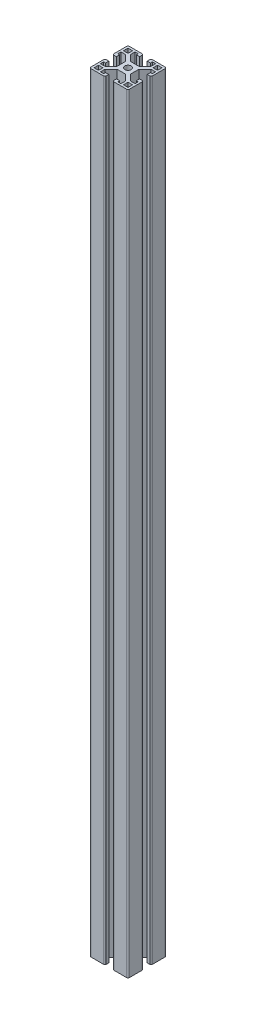
from build123d import *

# Parameters (mm, degrees)
SKETCH1_R           = 2.5
SKETCH1_W           = 3.5
SKETCH1_H           = 3.5
BOSS_EXTRUDE1_DEPTH = 600
FILLET1_R           = 1


with BuildPart() as part:
    # Sketch1 → Boss-Extrude1 (new body)
    with BuildSketch(Plane(origin=(0, 0, 0), x_dir=(1, 0, 0), z_dir=(0, 1, 0))):
        Polygon((-15, 7.5), (-15, -4.5), (-12, -4.5), (-12, -2), (-13.5, -2), (-13.5, 0.5), (-10, 0.5), (-5.25, -4.25), (-5.25, -10.75), (-10, -15.5), (-13.5, -15.5), (-13.5, -13), (-12, -13), (-12, -10.5), (-15, -10.5), (-15, -22.5), (-3, -22.5), (-3, -19.5), (-5.5, -19.5), (-5.5, -21), (-8, -21), (-8, -17.5), (-3.25, -12.75), (3.25, -12.75), (8, -17.5), (8, -21), (5.5, -21), (5.5, -19.5), (3, -19.5), (3, -22.5), (15, -22.5), (15, -10.5), (12, -10.5), (12, -13), (13.5, -13), (13.5, -15.5), (10, -15.5), (5.25, -10.75), (5.25, -4.25), (10, 0.5), (13.5, 0.5), (13.5, -2), (12, -2), (12, -4.5), (15, -4.5), (15, 7.5), (3, 7.5), (3, 4.5), (5.5, 4.5), (5.5, 6), (8, 6), (8, 2.5), (3.25, -2.25), (-3.25, -2.25), (-8, 2.5), (-8, 6), (-5.5, 6), (-5.5, 4.5), (-3, 4.5), (-3, 7.5), align=None)
        with Locations(Location((0, -7.5, 0), (0, 0, 270))):
            Circle(SKETCH1_R, mode=Mode.SUBTRACT)
        with Locations((-11.5, 4)):
            Rectangle(SKETCH1_W, SKETCH1_H, mode=Mode.SUBTRACT)
        with Locations((11.5, 4)):
            Rectangle(SKETCH1_W, SKETCH1_H, mode=Mode.SUBTRACT)
        with Locations((11.5, -19)):
            Rectangle(SKETCH1_W, SKETCH1_H, mode=Mode.SUBTRACT)
        with Locations((-11.5, -19)):
            Rectangle(SKETCH1_W, SKETCH1_H, mode=Mode.SUBTRACT)
    extrude(amount=-BOSS_EXTRUDE1_DEPTH)

    # Fillet1
    fillet1_edges = [part.edges().sort_by_distance(p)[0] for p in [
        (15, -300, 10.5),
        (15, -300, 22.5),
        (3, -300, 22.5),
        (-3, -300, 22.5),
        (-15, -300, 22.5),
        (-15, -300, 10.5),
        (-15, -300, 4.5),
        (-15, -300, -7.5),
        (-3, -300, -7.5),
        (3, -300, -7.5),
        (15, -300, -7.5),
        (15, -300, 4.5),
    ]]
    fillet(fillet1_edges, radius=FILLET1_R)


solid = part.part
